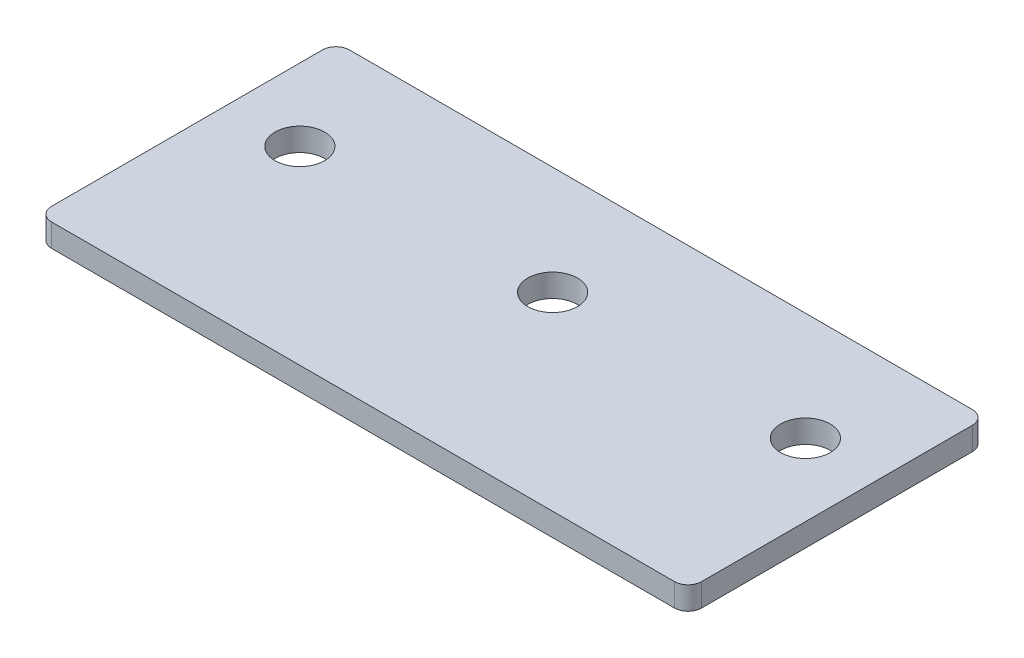
from build123d import *

# Parameters (mm, degrees)
SKETCH1_W           = 72
SKETCH1_H           = 33
SKETCH1_R           = 2.75
BOSS_EXTRUDE1_DEPTH = 2.54
FILLET1_R           = 1.5


with BuildPart() as part:
    # Sketch1 → Boss-Extrude1 (new body)
    with BuildSketch(Plane(origin=(0, 0, 0), x_dir=(1, 0, 0), z_dir=(0, 1, 0))):
        Rectangle(SKETCH1_W, SKETCH1_H)
        with Locations((-28, 4.5)):
            Circle(SKETCH1_R, mode=Mode.SUBTRACT)
        with Locations((0, 4.5)):
            Circle(SKETCH1_R, mode=Mode.SUBTRACT)
        with Locations((28, 4.5)):
            Circle(SKETCH1_R, mode=Mode.SUBTRACT)
    extrude(amount=BOSS_EXTRUDE1_DEPTH)

    # Fillet1
    fillet1_edges = [part.edges().sort_by_distance(p)[0] for p in [
        (-36, 1.27, -16.5),
        (36, 1.27, -16.5),
        (36, 1.27, 16.5),
        (-36, 1.27, 16.5),
    ]]
    fillet(fillet1_edges, radius=FILLET1_R)


solid = part.part
